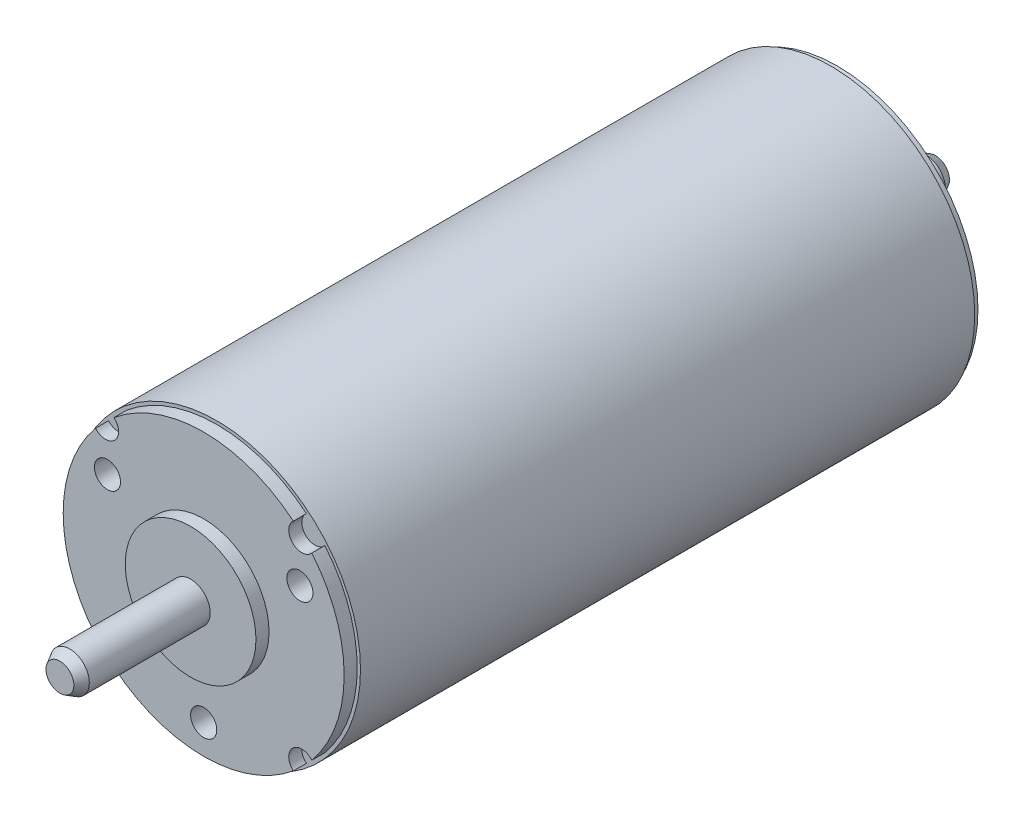
from build123d import *
from OCP.BRepFilletAPI import BRepFilletAPI_MakeChamfer

# Parameters (mm, degrees)
SKETCH1_R         = 11
EXTRUDE1_DEPTH    = 47
SKETCH2_R         = 10.75
EXTRUDE2_DEPTH    = 1
EXTRUDE3_START    = 0.5
SKETCH3_R         = 10.75
EXTRUDE3_DEPTH    = 0.5
SKETCH4_R         = 5
EXTRUDE4_DEPTH    = 1
EXTRUDE5_START    = 1
SKETCH5_R         = 5
EXTRUDE5_DEPTH    = 1
SKETCH6_R         = 1.5
EXTRUDE6_DEPTH    = 10
EXTRUDE7_START    = 6.5
SKETCH7_R         = 1.5
EXTRUDE7_DEPTH    = 6.5
CHAMFER1_SIZE     = 0.75
CHAMFER1_SIZE2    = 0.433012702
SKETCH8_R         = 1
EXTRUDE8_DEPTH    = 3
CIRPATTERN1_COUNT = 3
SKETCH9_R         = 0.8
EXTRUDE9_DEPTH    = 2.4
CIRPATTERN2_COUNT = 3
EXTRUDE10_START   = -1
EXTRUDE10_DEPTH   = 1
CIRPATTERN3_COUNT = 4


with BuildPart() as part:
    # Sketch1 → Extrude1 (new body)
    with BuildSketch(Plane.XY):
        Circle(SKETCH1_R)
    extrude(amount=EXTRUDE1_DEPTH)

    # Sketch2 → Extrude2 (add)
    with BuildSketch(Plane.XY.offset(47)):
        Circle(SKETCH2_R)
    extrude(amount=EXTRUDE2_DEPTH)

    # Sketch3 → Extrude3 (add)
    with BuildSketch(Plane(origin=(0, 0, 0), x_dir=(-1, 0, 0), z_dir=(0, 0, -1)).offset(EXTRUDE3_START)):
        with Locations(Location((0, 0, 0), (0, 0, 180))):
            Circle(SKETCH3_R)
    extrude(amount=-EXTRUDE3_DEPTH)

    # Sketch4 → Extrude4 (add)
    with BuildSketch(Plane.XY.offset(48)):
        Circle(SKETCH4_R)
    extrude(amount=EXTRUDE4_DEPTH)

    # Sketch5 → Extrude5 (add)
    with BuildSketch(Plane(origin=(0, 0, -0.5), x_dir=(-1, 0, 0), z_dir=(0, 0, -1)).offset(EXTRUDE5_START)):
        with Locations(Location((0, 0, 0), (0, 0, 180))):
            Circle(SKETCH5_R)
    extrude(amount=-EXTRUDE5_DEPTH)

    # Sketch6 → Extrude6 (add)
    with BuildSketch(Plane.XY.offset(49)):
        Circle(SKETCH6_R)
    extrude(amount=EXTRUDE6_DEPTH)

    # Sketch7 → Extrude7 (add)
    with BuildSketch(Plane(origin=(0, 0, -1.5), x_dir=(-1, 0, 0), z_dir=(0, 0, -1)).offset(EXTRUDE7_START)):
        with Locations(Location((0, 0, 0), (0, 0, 180))):
            Circle(SKETCH7_R)
    extrude(amount=-EXTRUDE7_DEPTH)

    # Chamfer1: one chamfer whose edges measure the first distance from different faces: ONE call of the kernel's chamfer builder (chamfer() names one face for all edges)
    chamfer1_edges_1 = [part.edges().sort_by_distance(p)[0] for p in [
        (-1.5, 0, 59),
    ]]
    chamfer1_side_1 = [part.faces().sort_by_distance(p)[0] for p in [
        (-1.5, 0, 54),
    ]]
    chamfer1_edges_2 = [part.edges().sort_by_distance(p)[0] for p in [
        (-1.5, 0, -8),
    ]]
    chamfer1_side_2 = [part.faces().sort_by_distance(p)[0] for p in [
        (-1.5, 0, -4.75),
    ]]
    chamfer1 = BRepFilletAPI_MakeChamfer(part.part.solid().wrapped)
    for e in chamfer1_edges_1:
        chamfer1.Add(CHAMFER1_SIZE, CHAMFER1_SIZE2, e.wrapped, chamfer1_side_1[0].wrapped)  # the first distance lies on this face
    for e in chamfer1_edges_2:
        chamfer1.Add(CHAMFER1_SIZE, CHAMFER1_SIZE2, e.wrapped, chamfer1_side_2[0].wrapped)  # the first distance lies on this face
    add(Compound.cast(chamfer1.Shape()), mode=Mode.REPLACE)

    # Sketch8 → Extrude8 (cut)
    with BuildSketch(Plane.XY.offset(48)):
        with Locations((0, -8.5)):
            Circle(SKETCH8_R)
    extrude8 = extrude(amount=-EXTRUDE8_DEPTH, mode=Mode.SUBTRACT)

    # CirPattern1: Extrude8 ×3 about axis
    cirpattern1_axis = Axis((0, 0, 0), (0, 0, 1))
    for i in range(1, CIRPATTERN1_COUNT):
        add(extrude8.rotate(cirpattern1_axis, i * 360 / CIRPATTERN1_COUNT), mode=Mode.SUBTRACT)

    # Sketch9 → Extrude9 (cut)
    with BuildSketch(Plane(origin=(0, 0, -0.5), x_dir=(-1, 0, 0), z_dir=(0, 0, -1))):
        with Locations((0, -7.5)):
            Circle(SKETCH9_R)
    extrude9 = extrude(amount=-EXTRUDE9_DEPTH, mode=Mode.SUBTRACT)

    # CirPattern2: Extrude9 ×3 about axis
    cirpattern2_axis = Axis((0, 0, 0), (0, 0, 1))
    for i in range(1, CIRPATTERN2_COUNT):
        add(extrude9.rotate(cirpattern2_axis, i * 360 / CIRPATTERN2_COUNT), mode=Mode.SUBTRACT)

    # Sketch11 → Extrude10 (cut)
    with BuildSketch(Plane.XY.offset(48).offset(EXTRUDE10_START)):
        with BuildLine():
            ThreePointArc((6.864194516, 8.273169505), (6.800769225, 6.800769225), (8.273169505, 6.864194516))
            ThreePointArc((8.273169505, 6.864194516), (7.601397898, 7.601397898), (6.864194516, 8.273169505))
        make_face()
    extrude10 = extrude(amount=EXTRUDE10_DEPTH, mode=Mode.SUBTRACT)

    # CirPattern3: Extrude10 ×4 about axis
    cirpattern3_axis = Axis((0, 0, 0), (0, 0, 1))
    for i in range(1, CIRPATTERN3_COUNT):
        add(extrude10.rotate(cirpattern3_axis, i * 360 / CIRPATTERN3_COUNT), mode=Mode.SUBTRACT)


solid = part.part
